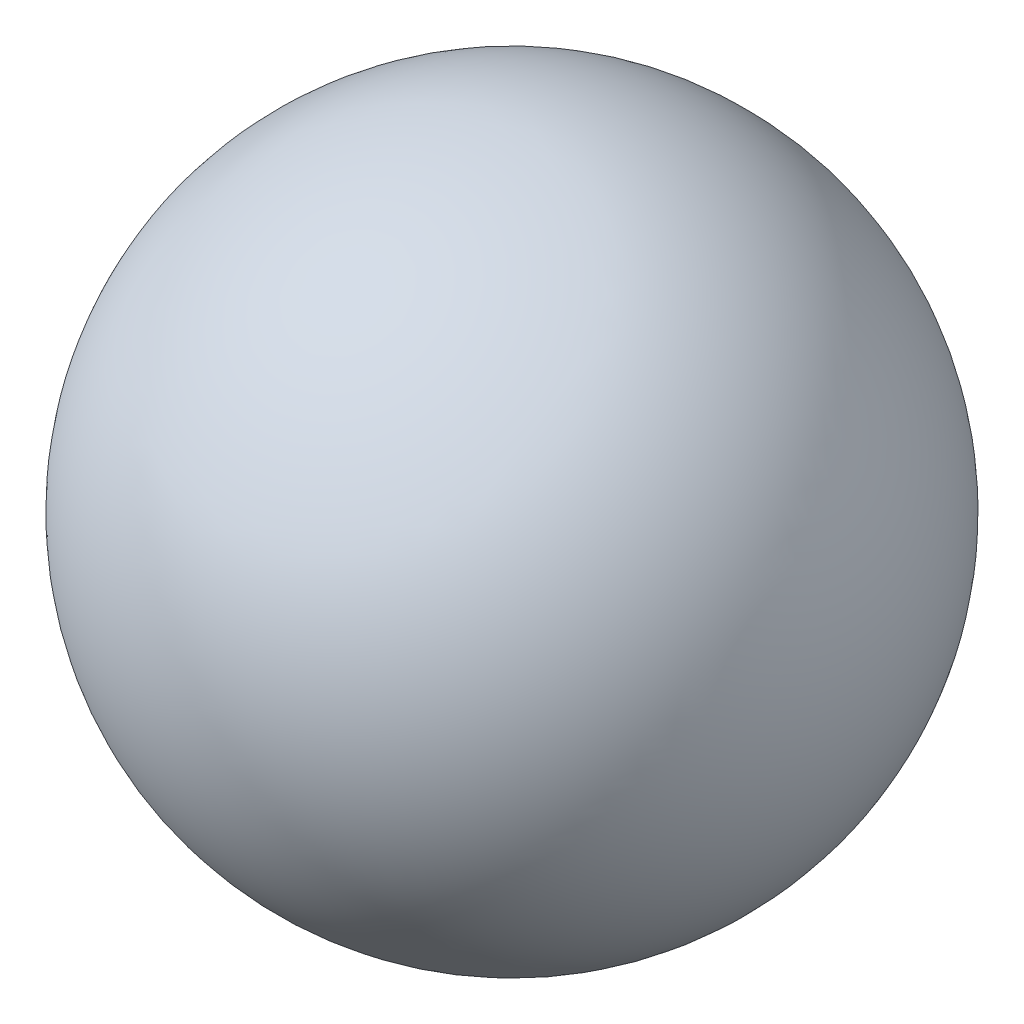
from build123d import *


with BuildPart() as part:
    # Sketch1 → Revolve1 (revolve)
    with BuildSketch(Plane.XY):
        with BuildLine():
            Line((2.794, 2.97), (1.206, 2.97))
            ThreePointArc((1.206, 2.97), (2, 3.764), (2.794, 2.97))
        make_face()
    revolve(axis=Axis((2.794, 2.97, 0), (-1, 0, 0)))


solid = part.part
